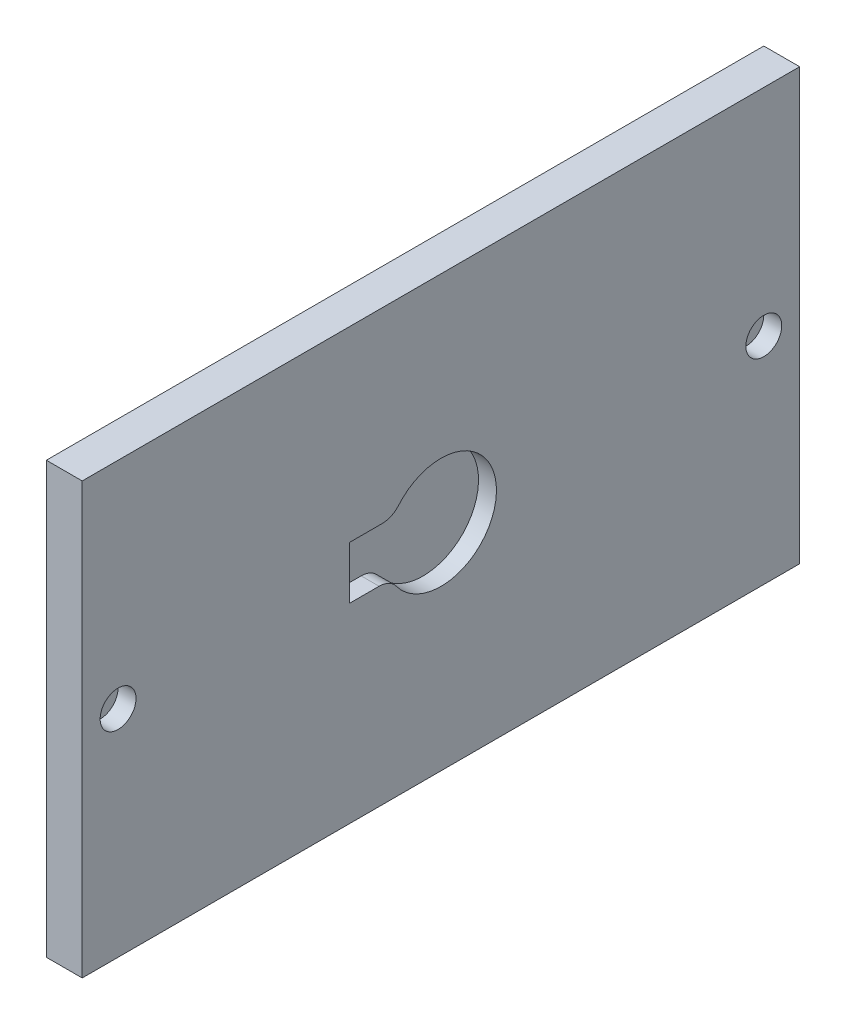
from build123d import *

# Parameters (mm, degrees)
SKETCH1_W                       = 254
SKETCH1_H                       = 152.4
BOSS_EXTRUDE1_DEPTH             = 12.7
SKETCH3_R                       = 6.35
CUT_EXTRUDE2_DEPTH              = 6.35
F_1_4_0_25_DIAMETER_HOLE1_D     = 6.35
F_1_4_0_25_DIAMETER_HOLE1_DEPTH = 12.7
F_1_4_0_25_DIAMETER_HOLE1_TIP   = 1.907732465
CUT_EXTRUDE3_DEPTH              = 6.35
FILLET1_R                       = 7.62


with BuildPart() as part:
    # Sketch1 → Boss-Extrude1 (new body)
    with BuildSketch(Plane(origin=(0, 0, 0), x_dir=(0, 0, -1), z_dir=(1, 0, 0))):
        Rectangle(SKETCH1_W, SKETCH1_H)
    extrude(amount=BOSS_EXTRUDE1_DEPTH)

    # Sketch3 → Cut-Extrude2 (cut)
    with BuildSketch(Plane(origin=(12.7, 0, 0), x_dir=(0, 0, -1), z_dir=(1, 0, 0))):
        with Locations((114.3, 0)):
            Circle(SKETCH3_R)
        with Locations((-114.3, 0)):
            Circle(SKETCH3_R)
    extrude(amount=-CUT_EXTRUDE2_DEPTH, mode=Mode.SUBTRACT)

    # 1/4 (0.25) Diameter Hole1
    with Locations(Plane(origin=(0, -76.2, 0), x_dir=(-1, 0, 0), z_dir=(0, -1, 0))):
        with Locations((-6.236337014, -114.3), (-6.236337014, 0), (-6.236337014, 114.3)):
            Hole(F_1_4_0_25_DIAMETER_HOLE1_D / 2, depth=F_1_4_0_25_DIAMETER_HOLE1_DEPTH)
            with Locations((0, 0, -(F_1_4_0_25_DIAMETER_HOLE1_DEPTH + F_1_4_0_25_DIAMETER_HOLE1_TIP / 2))):  # 118° drill point
                Cone(0, F_1_4_0_25_DIAMETER_HOLE1_D / 2, F_1_4_0_25_DIAMETER_HOLE1_TIP, mode=Mode.SUBTRACT)

    # Sketch7 → Cut-Extrude3 (cut)
    with BuildSketch(Plane(origin=(12.7, 0, 0), x_dir=(0, 0, -1), z_dir=(1, 0, 0))):
        with BuildLine():
            Line((0, 10.032875442), (0, -8.634963037))
            Line((0, -8.634963037), (-17.653050426, -8.634963037))
            ThreePointArc((-17.653050426, -8.634963037), (4.431634546, -19.145584119), (19.651788112, 0))
            ThreePointArc((19.651788112, 0), (5.202001486, 18.950777201), (-16.897756844, 10.032875442))
            Line((-16.897756844, 10.032875442), (0, 10.032875442))
        make_face()
        with BuildLine():
            Line((-17.653050426, -8.634963037), (0, -8.634963037))
            Line((0, -8.634963037), (0, 10.032875442))
            Line((0, 10.032875442), (-16.897756844, 10.032875442))
            ThreePointArc((-16.897756844, 10.032875442), (-19.635723036, 0.79445382), (-17.653050426, -8.634963037))
        make_face()
        with BuildLine():
            Line((-32.324736448, -8.634963037), (-17.653050426, -8.634963037))
            ThreePointArc((-17.653050426, -8.634963037), (-19.635723036, 0.79445382), (-16.897756844, 10.032875442))
            Line((-16.897756844, 10.032875442), (-32.324736448, 10.032875442))
            Line((-32.324736448, 10.032875442), (-32.324736448, -8.634963037))
        make_face()
    extrude(amount=-CUT_EXTRUDE3_DEPTH, mode=Mode.SUBTRACT)

    # Fillet1
    fillet1_edges = [part.edges().sort_by_distance(p)[0] for p in [
        (9.525, 10.032875442, 16.897756844),
        (9.525, -8.634963037, 17.653050426),
    ]]
    fillet(fillet1_edges, radius=FILLET1_R)


solid = part.part
